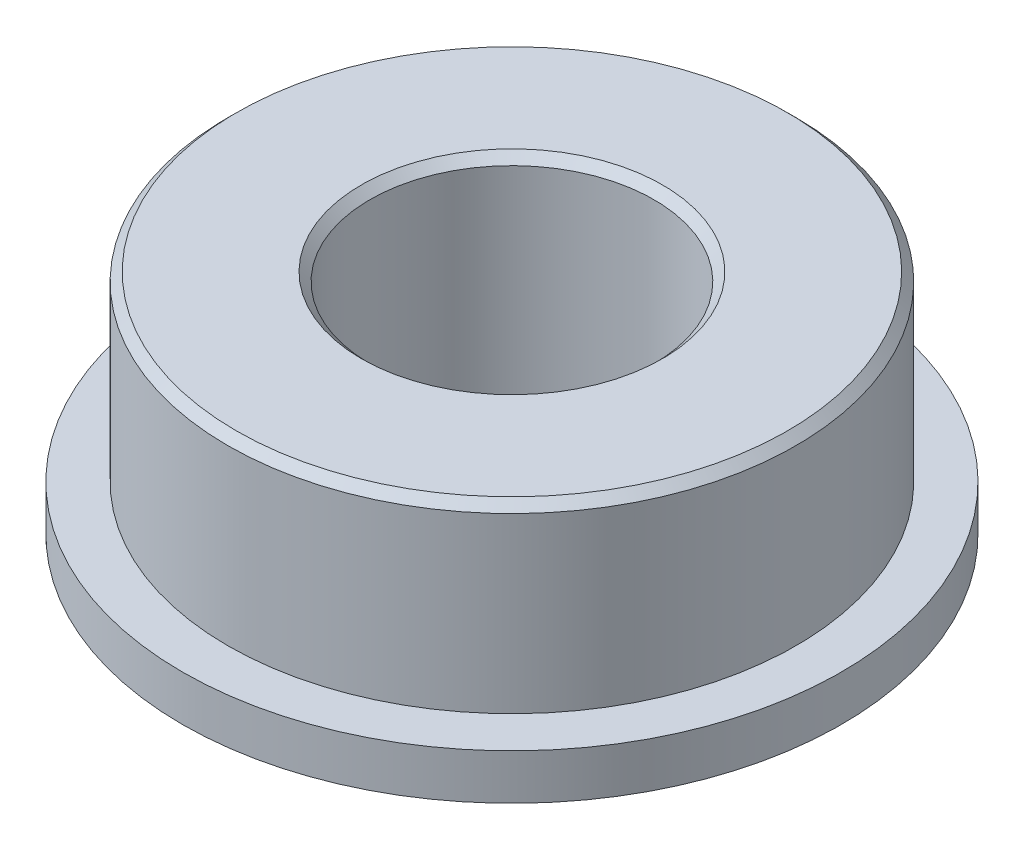
from build123d import *

# Parameters (mm, degrees)
CROQUIS1_R              = 5.8
CROQUIS1_R_2            = 5
SALIENTE_EXTRUIR1_DEPTH = 0.8
CROQUIS1_3_R            = 5
CROQUIS1_3_R_2          = 2.5
SALIENTE_EXTRUIR2_DEPTH = 4
CHAFL_N1_SIZE           = 0.15


with BuildPart() as part:
    # Croquis1 → Saliente-Extruir1 (new body)
    with BuildSketch(Plane(origin=(0, 0, 0), x_dir=(1, 0, 0), z_dir=(0, 1, 0))):
        Circle(CROQUIS1_R)
        Circle(CROQUIS1_R_2, mode=Mode.SUBTRACT)
    extrude(amount=SALIENTE_EXTRUIR1_DEPTH)

    # Croquis1<3> → Saliente-Extruir2 (add)
    with BuildSketch(Plane(origin=(0, 0, 0), x_dir=(1, 0, 0), z_dir=(0, 1, 0))):
        Circle(CROQUIS1_3_R)
        Circle(CROQUIS1_3_R_2, mode=Mode.SUBTRACT)
    extrude(amount=SALIENTE_EXTRUIR2_DEPTH)

    # Chaflán1
    chafl_n1_edges = [part.edges().sort_by_distance(p)[0] for p in [
        (-2.5, 0, 0),
        (-2.5, 4, 0),
        (-5, 4, 0),
    ]]
    chamfer(chafl_n1_edges, length=CHAFL_N1_SIZE)


solid = part.part
